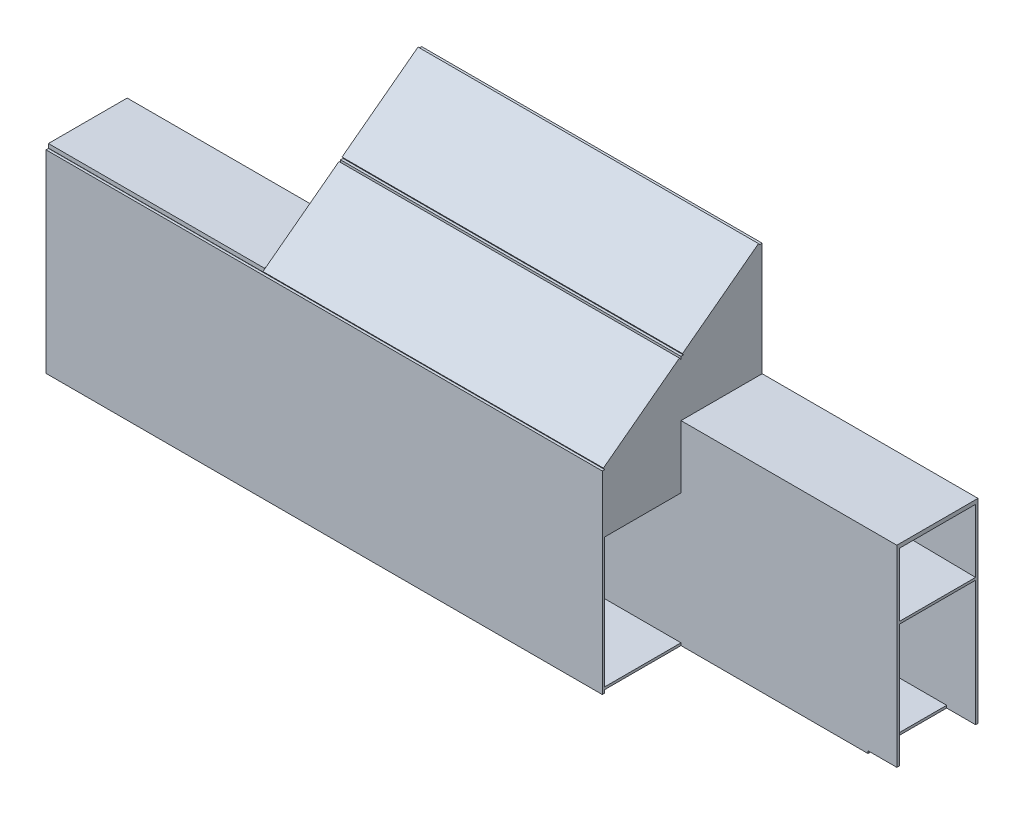
from build123d import *

# Parameters (mm, degrees)
EXTRUDE_1_DEPTH  = 8
EXTRUDE_2_DEPTH  = 8
EXTRUDE_3_DEPTH  = 8
SKETCH_7_W       = 1830
SKETCH_7_H       = 637
EXTRUDE_4_DEPTH  = 8
EXTRUDE_5_DEPTH  = 251
EXTRUDE_6_DEPTH  = 251
SKETCH_13_W      = 710
SKETCH_13_H      = 251
EXTRUDE_7_DEPTH  = 13
EXTRUDE_8_DEPTH  = 10
EXTRUDE_9_DEPTH  = 10
EXTRUDE_10_DEPTH = 1120
EXTRUDE_11_DEPTH = 1120


with BuildPart() as part:
    # ｽｹｯﾁ2 → ﾎﾞｽ - 押し出し1 (new body)
    with BuildSketch(Plane.XY.offset(259)):
        Polygon((0, 145), (2540, 145), (2540, 778), (1830, 778), (1830, 961), (710, 961), (710, 778), (0, 778), align=None)
    extrude(amount=EXTRUDE_1_DEPTH)

    # ｽｹｯﾁ4 → ﾎﾞｽ - 押し出し2 (add)
    with BuildSketch(Plane(origin=(0, 137, 0), x_dir=(1, 0, 0), z_dir=(0, 1, 0))):
        Polygon((95, -259), (710, -259), (710, -8), (2445, -8), (2445, -267), (1830, -267), (1830, -518), (95, -518), align=None)
    extrude(amount=EXTRUDE_2_DEPTH)

    # ｽｹｯﾁ5 → ﾎﾞｽ - 押し出し3 (add)
    with BuildSketch(Plane.XY):
        Polygon((710, 137), (2540, 137), (2540, 778), (1830, 778), (1830, 1150), (710, 1150), align=None)
    extrude(amount=EXTRUDE_3_DEPTH)

    # ｽｹｯﾁ7 → ﾎﾞｽ - 押し出し4 (add)
    with BuildSketch(Plane.XY.offset(518)):
        with Locations((915, 445.5)):
            Rectangle(SKETCH_7_W, SKETCH_7_H)
    extrude(amount=EXTRUDE_4_DEPTH)

    # ｽｹｯﾁ9 → ﾎﾞｽ - 押し出し5 (add)
    with BuildSketch(Plane.XY.offset(8)):
        Polygon((710, 574.32489), (2540, 548.7543), (2540, 556.7543), (710, 582.32489), align=None)
    extrude(amount=EXTRUDE_5_DEPTH)

    # ｽｹｯﾁ11 → ﾎﾞｽ - 押し出し6 (add)
    with BuildSketch(Plane.XY.offset(267)):
        Polygon((0, 548.7543), (1830, 574.32489), (1830, 582.32489), (0, 556.7543), align=None)
    extrude(amount=EXTRUDE_6_DEPTH)

    # ｽｹｯﾁ13 → ﾎﾞｽ - 押し出し7 (add)
    with BuildSketch(Plane(origin=(0, 765, 0), x_dir=(1, 0, 0), z_dir=(0, 1, 0))):
        with Locations((355, -392.5)):
            Rectangle(SKETCH_13_W, SKETCH_13_H)
        with Locations((2185, -133.5)):
            Rectangle(SKETCH_13_W, SKETCH_13_H)
    extrude(amount=EXTRUDE_7_DEPTH)

    # ｽｹｯﾁ15 → ﾎﾞｽ - 押し出し8 (add)
    with BuildSketch(Plane(origin=(710, 0, 0), x_dir=(0, 0, -1), z_dir=(1, 0, 0))):
        Polygon((-8, 572), (-259, 572), (-259, 961.319833243), (-8, 1150.461899818), align=None)
        Polygon((-267, 572), (-518, 572), (-518, 763.64506295), (-267, 952.787129526), align=None)
    extrude(amount=EXTRUDE_8_DEPTH)

    # ｽｹｯﾁ17 → ﾎﾞｽ - 押し出し9 (add)
    with BuildSketch(Plane(origin=(1820, 0, 0), x_dir=(0, 0, -1), z_dir=(1, 0, 0))):
        Polygon((-8, 572), (-259, 572), (-259, 961.319833243), (-8, 1150.461899818), align=None)
        Polygon((-267, 572), (-518, 572), (-518, 763.64506295), (-267, 952.787129526), align=None)
    extrude(amount=EXTRUDE_9_DEPTH)

    # ｽｹｯﾁ18 → ﾎﾞｽ - 押し出し10 (add)
    with BuildSketch(Plane(origin=(710, 0, 0), x_dir=(0, 0, -1), z_dir=(1, 0, 0))):
        Polygon((-12.14, 1154.855), (-262.14, 966.466487474), (-258.529109861, 961.674674414), (-8.529109861, 1150.06318694), align=None)
    extrude(amount=EXTRUDE_10_DEPTH)

    # ｽｹｯﾁ19 → ﾎﾞｽ - 押し出し11 (add)
    with BuildSketch(Plane(origin=(710, 0, 0), x_dir=(0, 0, -1), z_dir=(1, 0, 0))):
        Polygon((-272.34, 958.780236163), (-522.34, 770.391723638), (-517.525479815, 764.002639557), (-267.525479815, 952.391152083), align=None)
    extrude(amount=EXTRUDE_11_DEPTH)


solid = part.part
